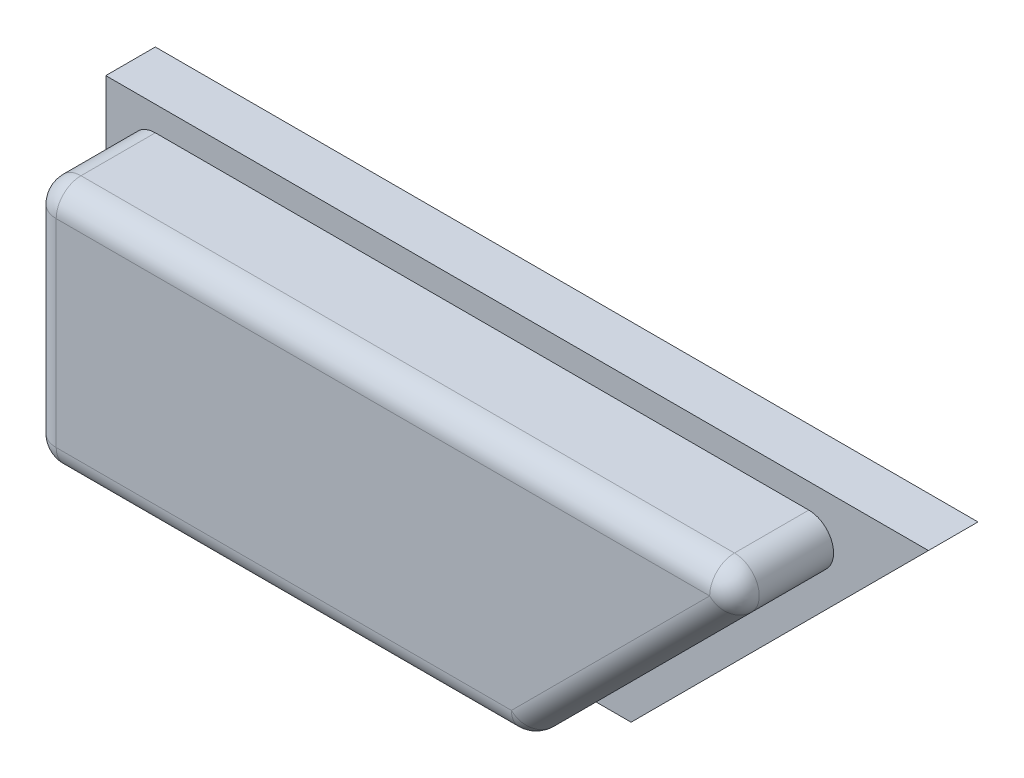
from build123d import *

# Parameters (mm, degrees)
BOSS_EXTRUDE1_DEPTH = 1
BOSS_EXTRUDE2_DEPTH = 2
FILLET1_R           = 0.5
FILLET2_R           = 0.5


with BuildPart() as part:
    # Sketch1 → Boss-Extrude1 (new body)
    with BuildSketch(Plane.XY):
        Polygon((0.185786438, 7), (6.185786438, 7), (0.185786438, 1), (-10.414213562, 1), (-10.414213562, 7), align=None)
    extrude(amount=BOSS_EXTRUDE1_DEPTH)

    # Sketch3 → Boss-Extrude2 (add)
    with BuildSketch(Plane.XY.offset(1)):
        Polygon((-0.621320344, 6.5), (4.978679656, 6.5), (-0.021320344, 1.5), (-9.914213562, 1.5), (-9.914213562, 6.5), align=None)
    extrude(amount=BOSS_EXTRUDE2_DEPTH)

    # Fillet1
    fillet1_edges = [part.edges().sort_by_distance(p)[0] for p in [
        (-9.914213562, 6.5, 2),
        (-9.914213562, 1.5, 2),
        (-0.021320344, 1.5, 2),
        (4.978679656, 6.5, 2),
    ]]
    fillet(fillet1_edges, radius=FILLET1_R)

    # Fillet2
    fillet2_edges = [part.edges().sort_by_distance(p)[0] for p in [
        (-2.821320344, 6.5, 3),
        (2.125126266, 3.646446609, 3),
        (-9.914213562, 4, 3),
        (-4.821320344, 1.5, 3),
        (-0.037085409, 1.538060234, 3),
        (-9.767766953, 1.646446609, 3),
        (-9.767766953, 6.353553391, 3),
        (4.233512642, 6.191341716, 3),
    ]]
    fillet(fillet2_edges, radius=FILLET2_R)


solid = part.part
